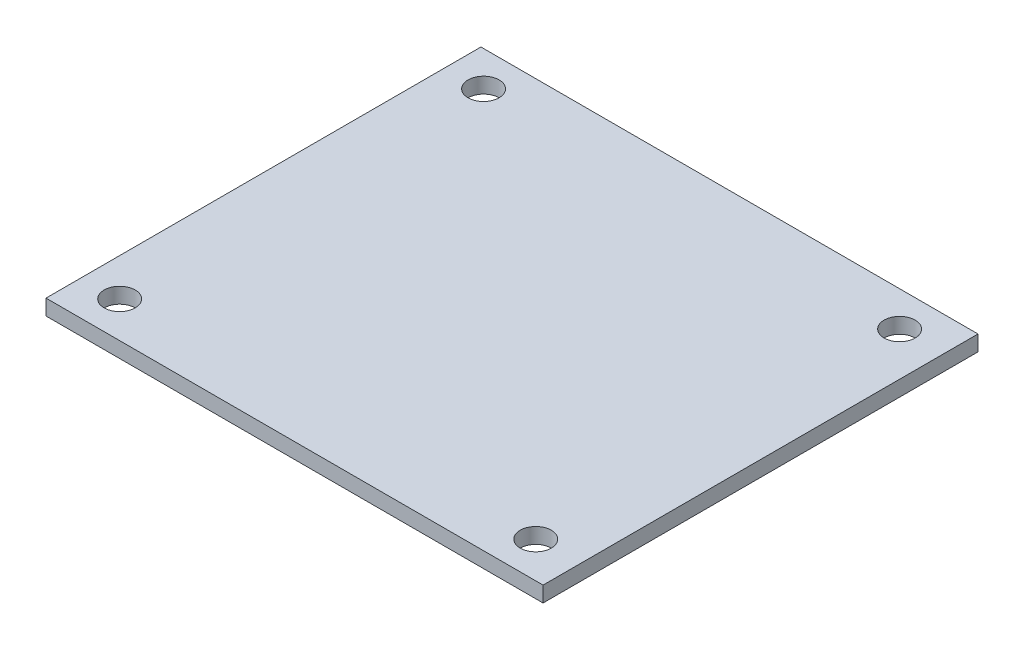
from build123d import *

# Parameters (mm, degrees)
SKETCH1_W           = 48
SKETCH1_H           = 42
BOSS_EXTRUDE1_DEPTH = 1.5
SKETCH2_R           = 1.5
CUT_EXTRUDE1_DEPTH  = 32.925694981


with BuildPart() as part:
    # Sketch1 → Boss-Extrude1 (new body)
    with BuildSketch(Plane(origin=(0, 0, 0), x_dir=(1, 0, 0), z_dir=(0, 1, 0))):
        Rectangle(SKETCH1_W, SKETCH1_H)
    extrude(amount=BOSS_EXTRUDE1_DEPTH)

    # Sketch2 → Cut-Extrude1 (cut, through all)
    with BuildSketch(Plane(origin=(0, 1.5, 0), x_dir=(1, 0, 0), z_dir=(0, 1, 0))):
        with Locations(Location((-20.371705676, 17.627184217, 0), (0, 0, 270))):
            Circle(SKETCH2_R)
        with Locations(Location((19.805824962, 17.627184217, 0), (0, 0, 270))):
            Circle(SKETCH2_R)
        with Locations(Location((19.805824962, -17.514008074, 0), (0, 0, 270))):
            Circle(SKETCH2_R)
        with Locations(Location((-20.371705676, -17.514008074, 0), (0, 0, 270))):
            Circle(SKETCH2_R)
    extrude(amount=-CUT_EXTRUDE1_DEPTH, mode=Mode.SUBTRACT)


solid = part.part
